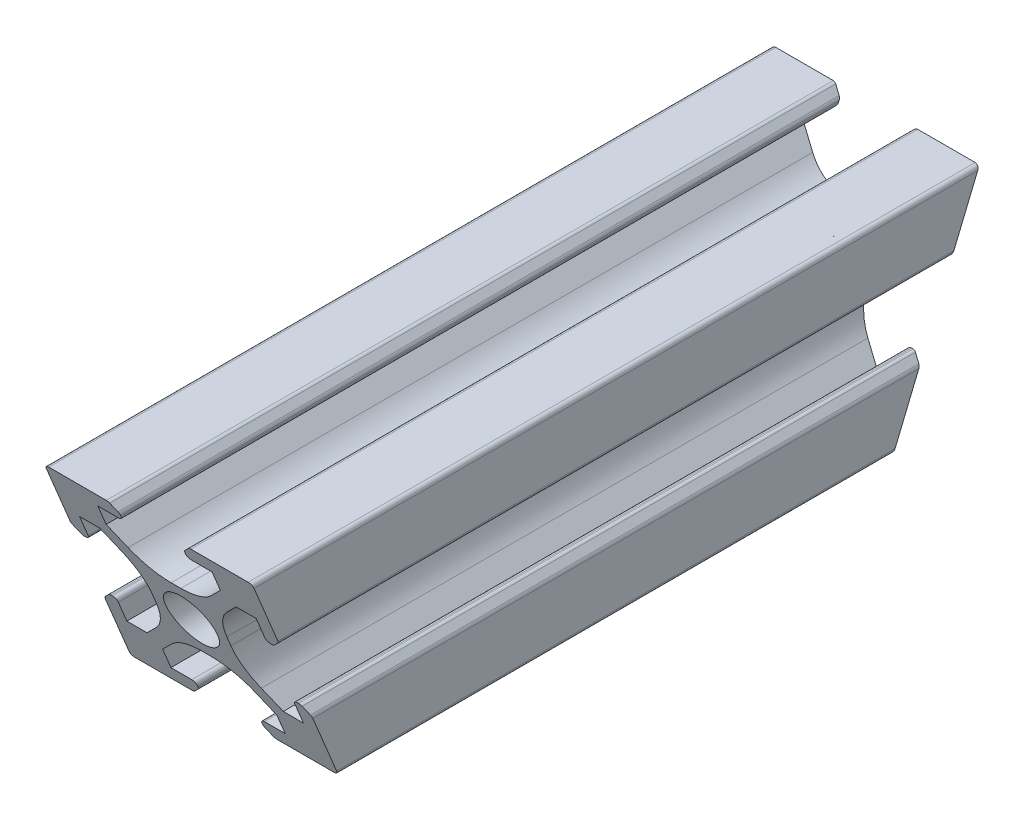
from build123d import *

# Parameters (mm, degrees)
RESSALTO_EXTRUS_O1_DEPTH = 70
PADR_OCIRCULAR1_COUNT    = 4
FILETE1_R                = 0.4
SKETCH3_R                = 2
CUT_EXTRUDE2_DEPTH       = 74.484692283
CUT_EXTRUDE1_DEPTH       = 74.484692379
SKETCH4_R                = 1.5
CUT_EXTRUDE3_DEPTH       = 74.484692283


with BuildPart() as part:
    # Esboço1 → Ressalto-extrusão1 (new body)
    with BuildSketch(Plane.XY):
        with BuildLine():
            ThreePointArc((-9.317157288, 3.217157288), (-9.187387948, 3.130448187), (-9.034314575, 3.1))
            Line((-9.034314575, 3.1), (-8.9, 3.1))
            ThreePointArc((-8.9, 3.1), (-8.617157288, 3.217157288), (-8.5, 3.5))
            Line((-8.5, 3.5), (-8.5, 5.5))
            Line((-8.5, 5.5), (-6.560660172, 5.5))
            Line((-6.560660172, 5.5), (-5.064466094, 4.003805922))
            ThreePointArc((-5.064466094, 4.003805922), (-3.980602337, 2.381689178), (-3.6, 0.468272016))
            Line((-3.6, 0.468272016), (-3.6, 0))
            Line((-3.6, 0), (-2.5, 0))
            ThreePointArc((-2.5, 0), (-1.767766953, 1.767766953), (0, 2.5))
            Line((0, 2.5), (0, 3.6))
            Line((0, 3.6), (-0.468272016, 3.6))
            ThreePointArc((-0.468272016, 3.6), (-2.381689178, 3.980602337), (-4.003805922, 5.064466094))
            Line((-4.003805922, 5.064466094), (-5.5, 6.560660172))
            Line((-5.5, 6.560660172), (-5.5, 8.5))
            Line((-5.5, 8.5), (-3.5, 8.5))
            ThreePointArc((-3.5, 8.5), (-3.217157288, 8.617157288), (-3.1, 8.9))
            Line((-3.1, 8.9), (-3.1, 9.034314575))
            ThreePointArc((-3.1, 9.034314575), (-3.130448187, 9.187387948), (-3.217157288, 9.317157288))
            Line((-3.217157288, 9.317157288), (-3.782842712, 9.882842712))
            ThreePointArc((-3.782842712, 9.882842712), (-3.912612052, 9.969551813), (-4.065685425, 10))
            Line((-4.065685425, 10), (-10, 10))
            Line((-10, 10), (-10, 4.065685425))
            ThreePointArc((-10, 4.065685425), (-9.969551813, 3.912612052), (-9.882842712, 3.782842712))
            Line((-9.882842712, 3.782842712), (-9.317157288, 3.217157288))
        make_face()
    ressalto_extrus_o1 = extrude(amount=RESSALTO_EXTRUS_O1_DEPTH)

    # PadrãoCircular1: Ressalto-extrusão1 ×4 about axis
    padr_ocircular1_axis = Axis((0, 0, 0), (0, 0, 1))
    for i in range(1, PADR_OCIRCULAR1_COUNT):
        add(ressalto_extrus_o1.rotate(padr_ocircular1_axis, i * 360 / PADR_OCIRCULAR1_COUNT))

    # Filete1
    filete1_edges = [part.edges().sort_by_distance(p)[0] for p in [
        (-10, -10, 35),
        (-10, 10, 35),
        (10, -10, 35),
        (10, 10, 35),
    ]]
    fillet(filete1_edges, radius=FILETE1_R)

    # Sketch3 → Cut-Extrude2 (cut, through all)
    with BuildSketch(Plane(origin=(10, 0, 0), x_dir=(0, 0, -1), z_dir=(1, 0, 0))):
        with Locations((-25, 0)):
            Circle(SKETCH3_R)
        with Locations((-45, 0)):
            Circle(SKETCH3_R)
    extrude(amount=-CUT_EXTRUDE2_DEPTH, mode=Mode.SUBTRACT)

    # Sketch1 → Cut-Extrude1 (cut, through all)
    with BuildSketch(Plane.ZY.offset(10)):
        Polygon((0, 10), (0, -10), (8.284271247, -10), align=None)
        Polygon((70, 10), (61.715728753, -10), (70, -10), align=None)
    extrude(amount=-CUT_EXTRUDE1_DEPTH, mode=Mode.SUBTRACT)

    # Sketch4 → Cut-Extrude3 (cut, through all)
    with BuildSketch(Plane(origin=(10, 0, 0), x_dir=(0, 0, -1), z_dir=(1, 0, 0))):
        with Locations((-18, 0)):
            Circle(SKETCH4_R)
        with Locations((-11, 0)):
            Circle(SKETCH4_R)
        with Locations((-52, 0)):
            Circle(SKETCH4_R)
        with Locations((-59, 0)):
            Circle(SKETCH4_R)
    extrude(amount=-CUT_EXTRUDE3_DEPTH, mode=Mode.SUBTRACT)


solid = part.part
